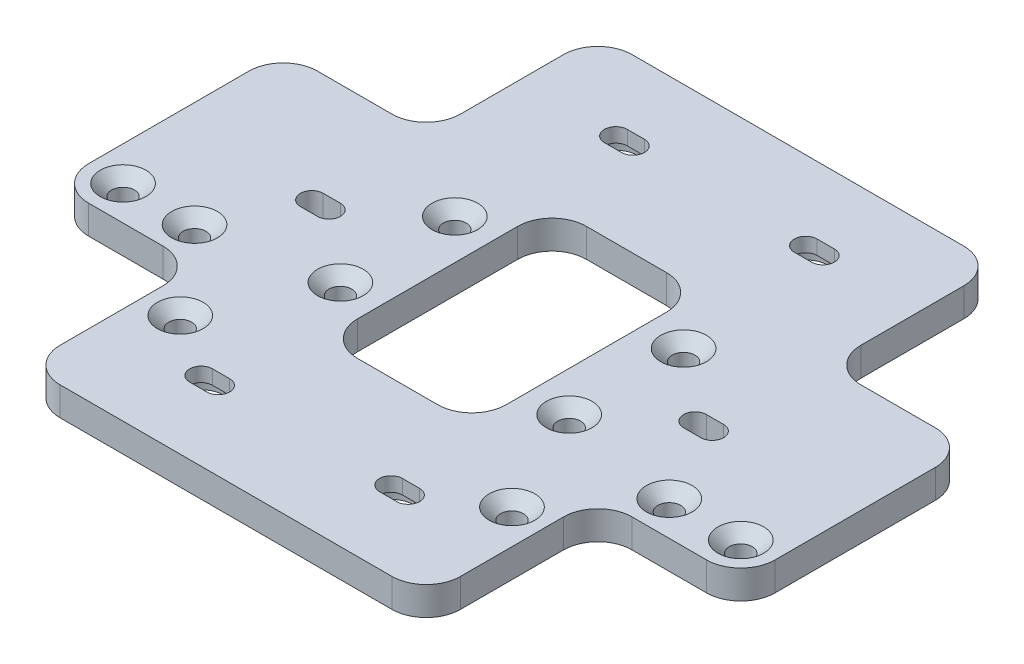
from build123d import *

# Parameters (mm, degrees)
ESQUISSE1_R             = 2
BOSS_EXTRU_1_DEPTH      = 5
CHANFREIN1_SIZE         = 2
ENL_V_MAT_EXTRU_1_DEPTH = 2.5


with BuildPart() as part:
    # Esquisse1 → Boss.-Extru.1 (new body)
    with BuildSketch(Plane(origin=(0, 0, 0), x_dir=(1, 0, 0), z_dir=(0, 1, 0))):
        with BuildLine():
            Line((60, 14), (60, -14))
            ThreePointArc((60, -14), (58.242640687, -18.242640687), (54, -20))
            Line((54, -20), (41, -20))
            ThreePointArc((41, -20), (36.757359313, -21.757359313), (35, -26))
            Line((35, -26), (35, -44))
            ThreePointArc((35, -44), (33.242640687, -48.242640687), (29, -50))
            Line((29, -50), (-29, -50))
            ThreePointArc((-29, -50), (-33.242640687, -48.242640687), (-35, -44))
            Line((-35, -44), (-35, -26))
            ThreePointArc((-35, -26), (-36.757359313, -21.757359313), (-41, -20))
            Line((-41, -20), (-54, -20))
            ThreePointArc((-54, -20), (-58.242640687, -18.242640687), (-60, -14))
            Line((-60, -14), (-60, 14))
            ThreePointArc((-60, 14), (-58.242640687, 18.242640687), (-54, 20))
            Line((-54, 20), (-41, 20))
            ThreePointArc((-41, 20), (-36.757359313, 21.757359313), (-35, 26))
            Line((-35, 26), (-35, 44))
            ThreePointArc((-35, 44), (-33.242640687, 48.242640687), (-29, 50))
            Line((-29, 50), (29, 50))
            ThreePointArc((29, 50), (33.242640687, 48.242640687), (35, 44))
            Line((35, 44), (35, 26))
            ThreePointArc((35, 26), (36.757359313, 21.757359313), (41, 20))
            Line((41, 20), (54, 20))
            ThreePointArc((54, 20), (58.242640687, 18.242640687), (60, 14))
        make_face()
        with Locations(Location((20, -10, 0), (0, 0, 90))):
            Circle(ESQUISSE1_R, mode=Mode.SUBTRACT)
        with Locations(Location((-20, -10, 0), (0, 0, 270))):
            Circle(ESQUISSE1_R, mode=Mode.SUBTRACT)
        with Locations(Location((-54, -14, 0), (0, 0, 270))):
            Circle(ESQUISSE1_R, mode=Mode.SUBTRACT)
        with Locations(Location((20, 10, 0), (0, 0, 270))):
            Circle(ESQUISSE1_R, mode=Mode.SUBTRACT)
        with Locations(Location((-20, 10, 0), (0, 0, 90))):
            Circle(ESQUISSE1_R, mode=Mode.SUBTRACT)
        with Locations(Location((-41.5, -14, 0), (0, 0, 270))):
            Circle(ESQUISSE1_R, mode=Mode.SUBTRACT)
        with Locations(Location((-29, -29, 0), (0, 0, 270))):
            Circle(ESQUISSE1_R, mode=Mode.SUBTRACT)
        with Locations(Location((54, -14, 0), (0, 0, 90))):
            Circle(ESQUISSE1_R, mode=Mode.SUBTRACT)
        with Locations(Location((41.5, -14, 0), (0, 0, 90))):
            Circle(ESQUISSE1_R, mode=Mode.SUBTRACT)
        with Locations(Location((29, -29, 0), (0, 0, 90))):
            Circle(ESQUISSE1_R, mode=Mode.SUBTRACT)
        with BuildLine():
            Line((35, -2), (32, -2))
            ThreePointArc((32, -2), (30, 0), (32, 2))
            Line((32, 2), (35, 2))
            ThreePointArc((35, 2), (37, 0), (35, -2))
        make_face(mode=Mode.SUBTRACT)
        with BuildLine():
            Line((13, -14), (13, 14))
            ThreePointArc((13, 14), (11.242640687, 18.242640687), (7, 20))
            Line((7, 20), (-7, 20))
            ThreePointArc((-7, 20), (-11.242640687, 18.242640687), (-13, 14))
            Line((-13, 14), (-13, -14))
            ThreePointArc((-13, -14), (-11.242640687, -18.242640687), (-7, -20))
            Line((-7, -20), (7, -20))
            ThreePointArc((7, -20), (11.242640687, -18.242640687), (13, -14))
        make_face(mode=Mode.SUBTRACT)
        with BuildLine():
            Line((-18.1, -34.25451696), (-15.099999825, -34.25451696))
            ThreePointArc((-15.099999825, -34.25451696), (-13.1, -36.25451696), (-15.099999825, -38.25451696))
            Line((-15.099999825, -38.25451696), (-18.1, -38.25451696))
            ThreePointArc((-18.1, -38.25451696), (-20.1, -36.25451696), (-18.1, -34.25451696))
        make_face(mode=Mode.SUBTRACT)
        with BuildLine():
            Line((-35, -2), (-32, -2))
            ThreePointArc((-32, -2), (-30, 0), (-32, 2))
            Line((-32, 2), (-35, 2))
            ThreePointArc((-35, 2), (-37, 0), (-35, -2))
        make_face(mode=Mode.SUBTRACT)
        with BuildLine():
            Line((18.1, -34.25451696), (15.099999825, -34.25451696))
            ThreePointArc((15.099999825, -34.25451696), (13.1, -36.25451696), (15.099999825, -38.25451696))
            Line((15.099999825, -38.25451696), (18.1, -38.25451696))
            ThreePointArc((18.1, -38.25451696), (20.1, -36.25451696), (18.1, -34.25451696))
        make_face(mode=Mode.SUBTRACT)
        with BuildLine():
            Line((-18.1, 38.25451696), (-15.099999825, 38.25451696))
            ThreePointArc((-15.099999825, 38.25451696), (-13.1, 36.25451696), (-15.099999825, 34.25451696))
            Line((-15.099999825, 34.25451696), (-18.1, 34.25451696))
            ThreePointArc((-18.1, 34.25451696), (-20.1, 36.25451696), (-18.1, 38.25451696))
        make_face(mode=Mode.SUBTRACT)
        with BuildLine():
            Line((18.1, 38.25451696), (15.099999825, 38.25451696))
            ThreePointArc((15.099999825, 38.25451696), (13.1, 36.25451696), (15.099999825, 34.25451696))
            Line((15.099999825, 34.25451696), (18.1, 34.25451696))
            ThreePointArc((18.1, 34.25451696), (20.1, 36.25451696), (18.1, 38.25451696))
        make_face(mode=Mode.SUBTRACT)
    extrude(amount=BOSS_EXTRU_1_DEPTH)

    # Chanfrein1
    chanfrein1_edges = [part.edges().sort_by_distance(p)[0] for p in [
        (20, 5, 12),
        (-20, 5, 8),
        (20, 5, -12),
        (-20, 5, -8),
        (-54, 5, 12),
        (-41.5, 5, 12),
        (-29, 5, 27),
        (54, 5, 16),
        (41.5, 5, 16),
        (29, 5, 31),
    ]]
    chamfer(chanfrein1_edges, length=CHANFREIN1_SIZE)

    # Esquisse2 → Enlèv. mat.-Extru.1 (cut)
    with BuildSketch(Plane.XZ):
        with BuildLine():
            Line((-18.1, -32.25451696), (-15.1, -32.25451696))
            ThreePointArc((-15.1, -32.25451696), (-11.1, -36.25451696), (-15.1, -40.25451696))
            Line((-15.1, -40.25451696), (-18.1, -40.25451696))
            ThreePointArc((-18.1, -40.25451696), (-22.1, -36.25451696), (-18.1, -32.25451696))
        make_face()
        with BuildLine():
            Line((-18.1, 40.25451696), (-15.1, 40.25451696))
            ThreePointArc((-15.1, 40.25451696), (-11.1, 36.25451696), (-15.1, 32.25451696))
            Line((-15.1, 32.25451696), (-18.1, 32.25451696))
            ThreePointArc((-18.1, 32.25451696), (-22.1, 36.25451696), (-18.1, 40.25451696))
        make_face()
        with BuildLine():
            Line((18.1, 32.25451696), (15.1, 32.25451696))
            ThreePointArc((15.1, 32.25451696), (11.1, 36.25451696), (15.1, 40.25451696))
            Line((15.1, 40.25451696), (18.1, 40.25451696))
            ThreePointArc((18.1, 40.25451696), (22.1, 36.25451696), (18.1, 32.25451696))
        make_face()
        with BuildLine():
            Line((18.1, -40.25451696), (15.1, -40.25451696))
            ThreePointArc((15.1, -40.25451696), (11.1, -36.25451696), (15.1, -32.25451696))
            Line((15.1, -32.25451696), (18.1, -32.25451696))
            ThreePointArc((18.1, -32.25451696), (22.1, -36.25451696), (18.1, -40.25451696))
        make_face()
    extrude(amount=-ENL_V_MAT_EXTRU_1_DEPTH, mode=Mode.SUBTRACT)


solid = part.part
